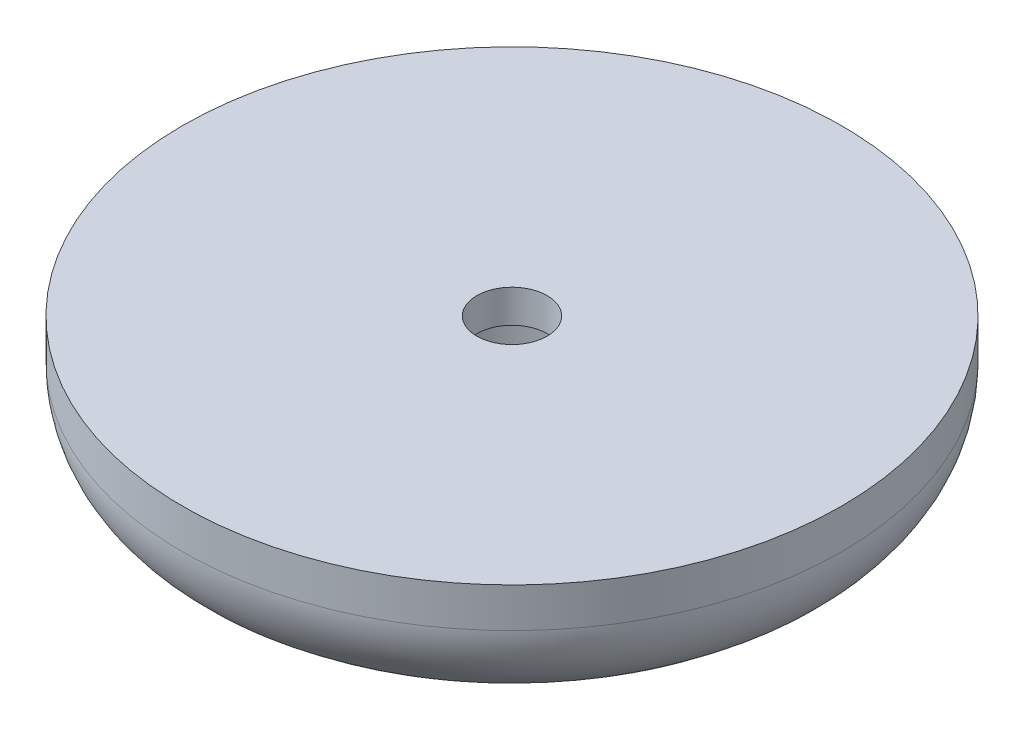
from build123d import *

# Parameters (mm, degrees)
SKETCH1_W                      = 15
SKETCH1_H                      = 5.8
CBORE_FOR_M3_SHCS1_D           = 3.2
CBORE_FOR_M3_SHCS1_CBORE_D     = 8
CBORE_FOR_M3_SHCS1_CBORE_DEPTH = 4.3
FILLET2_R                      = 4
FILLET3_R                      = 1


with BuildPart() as part:
    # Sketch1 → Revolve1 (revolve)
    with BuildSketch(Plane.XY, mode=Mode.PRIVATE) as revolve1_sk:
        with Locations((7.5, -2.9)):
            Rectangle(SKETCH1_W, SKETCH1_H)
    revolve(revolve1_sk.sketch.rotate(Axis((0, 0, 0), (0, -1, 0)), 180), axis=Axis((0, 0, 0), (0, -1, 0)))

    # CBORE for M3 SHCS1 (through all)
    with Locations(Plane(origin=(0, -5.8, 0), x_dir=(-1, 0, 0), z_dir=(0, -1, 0))):
        with Locations((0, 0)):
            CounterBoreHole(CBORE_FOR_M3_SHCS1_D / 2, CBORE_FOR_M3_SHCS1_CBORE_D / 2, CBORE_FOR_M3_SHCS1_CBORE_DEPTH)

    # Fillet2
    fillet2_edges = [part.edges().sort_by_distance(p)[0] for p in [
        (15, -5.8, 0),
    ]]
    fillet(fillet2_edges, radius=FILLET2_R)

    # Fillet3
    fillet3_edges = [part.edges().sort_by_distance(p)[0] for p in [
        (4, -5.8, 0),
    ]]
    fillet(fillet3_edges, radius=FILLET3_R)


solid = part.part
